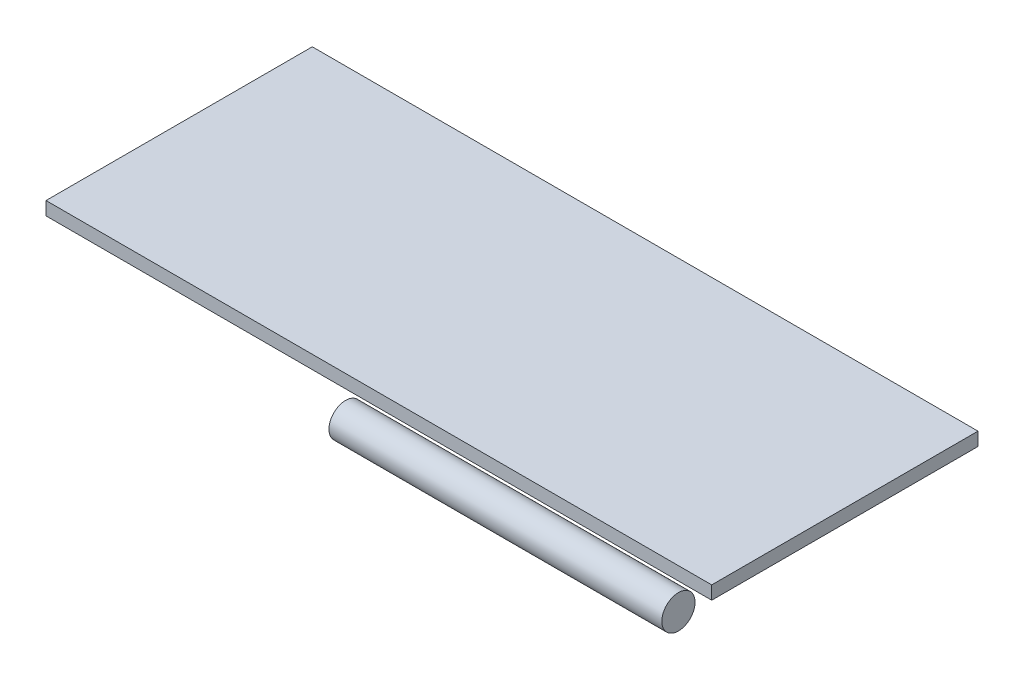
from build123d import *

# Parameters (mm, degrees)
SKETCH1_W           = 100
SKETCH1_H           = 40
BOSS_EXTRUDE1_DEPTH = 2
SKETCH2_R           = 2.5
BOSS_EXTRUDE2_DEPTH = 50


with BuildPart() as part:
    # Sketch1 → Boss-Extrude1 (new body)
    with BuildSketch(Plane(origin=(0, 0, 0), x_dir=(1, 0, 0), z_dir=(0, 1, 0))):
        Rectangle(SKETCH1_W, SKETCH1_H)
    extrude(amount=BOSS_EXTRUDE1_DEPTH)


with BuildPart() as body_2:
    # Sketch2 → Boss-Extrude2 (new body)
    with BuildSketch(Plane(origin=(50, 0, 0), x_dir=(0, 0, -1), z_dir=(1, 0, 0))):
        with Locations((-25, 1)):
            Circle(SKETCH2_R)
    extrude(amount=-BOSS_EXTRUDE2_DEPTH)


solid = Compound([part.part, body_2.part])
